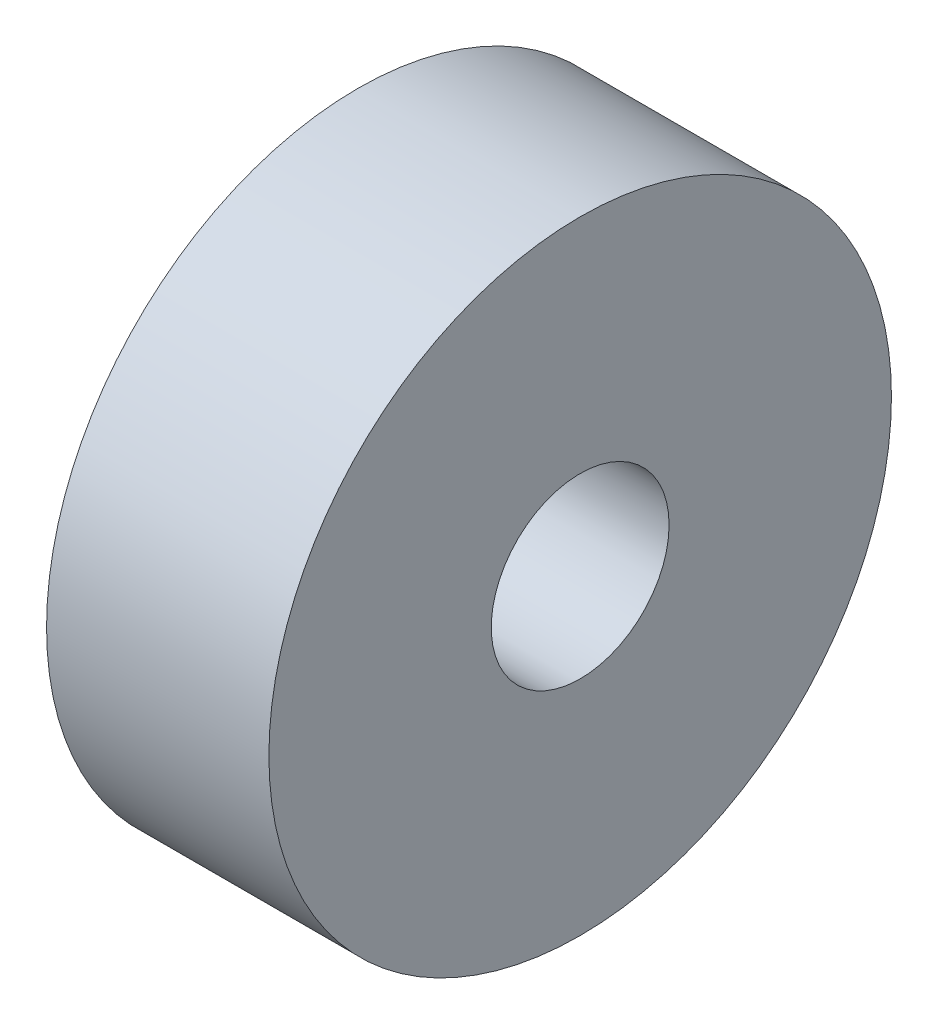
from build123d import *

# Parameters (mm, degrees)
SKETCH1_R           = 14
SKETCH1_R_2         = 4
BOSS_EXTRUDE1_DEPTH = 10


with BuildPart() as part:
    # Sketch1 → Boss-Extrude1 (new body)
    with BuildSketch(Plane(origin=(0, 0, 0), x_dir=(0, 0, -1), z_dir=(1, 0, 0))):
        Circle(SKETCH1_R)
        Circle(SKETCH1_R_2, mode=Mode.SUBTRACT)
    extrude(amount=BOSS_EXTRUDE1_DEPTH)


solid = part.part
